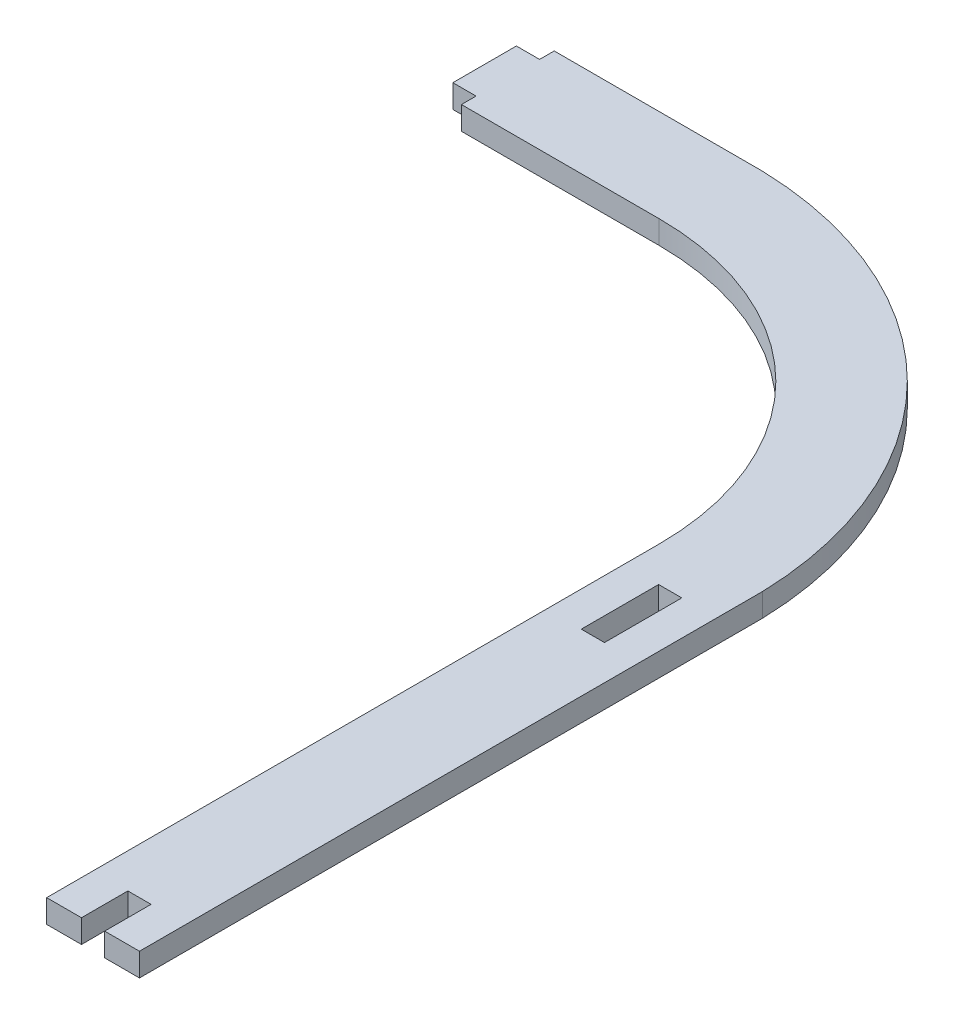
from build123d import *

# Parameters (mm, degrees)
SALIENTE_EXTRUIR1_DEPTH = 3


with BuildPart() as part:
    # Croquis1 → Saliente-Extruir1 (new body)
    with BuildSketch(Plane(origin=(0, 0, 0), x_dir=(1, 0, 0), z_dir=(0, 1, 0))):
        with BuildLine():
            Line((0, 7.786096257), (0, 0))
            Line((0, 0), (0, -0.213903743))
            Line((0, -0.213903743), (3, -0.213903743))
            Line((3, -0.213903743), (3, -2.106951872))
            Line((3, -2.106951872), (7.35828877, -2.106951872))
            Line((7.35828877, -2.106951872), (28.573593129, -2.106951872))
            ThreePointArc((28.573593129, -2.106951872), (54.330952442, -12.77599943), (65, -38.533358743))
            Line((65, -38.533358743), (65, -117.736951872))
            Line((65, -117.736951872), (69.5, -117.736951872))
            Line((69.5, -117.736951872), (69.5, -111.736951872))
            Line((69.5, -111.736951872), (72.5, -111.736951872))
            Line((72.5, -111.736951872), (72.5, -117.736951872))
            Line((72.5, -117.736951872), (77, -117.736951872))
            Line((77, -117.736951872), (77, -37.153707926))
            ThreePointArc((77, -37.153707926), (62.830127679, -4.276824192), (29.953243946, 9.893048128))
            Line((29.953243946, 9.893048128), (7.35828877, 9.893048128))
            Line((7.35828877, 9.893048128), (3, 9.893048128))
            Line((3, 9.893048128), (3, 8))
            Line((3, 8), (0, 8))
            Line((0, 8), (0, 7.786096257))
        make_face()
        Polygon((69.5, -53.106951872), (69.5, -48.106951872), (69.5, -43.106951872), (72.5, -43.106951872), (72.5, -53.106951872), align=None, mode=Mode.SUBTRACT)
    extrude(amount=SALIENTE_EXTRUIR1_DEPTH)


solid = part.part
